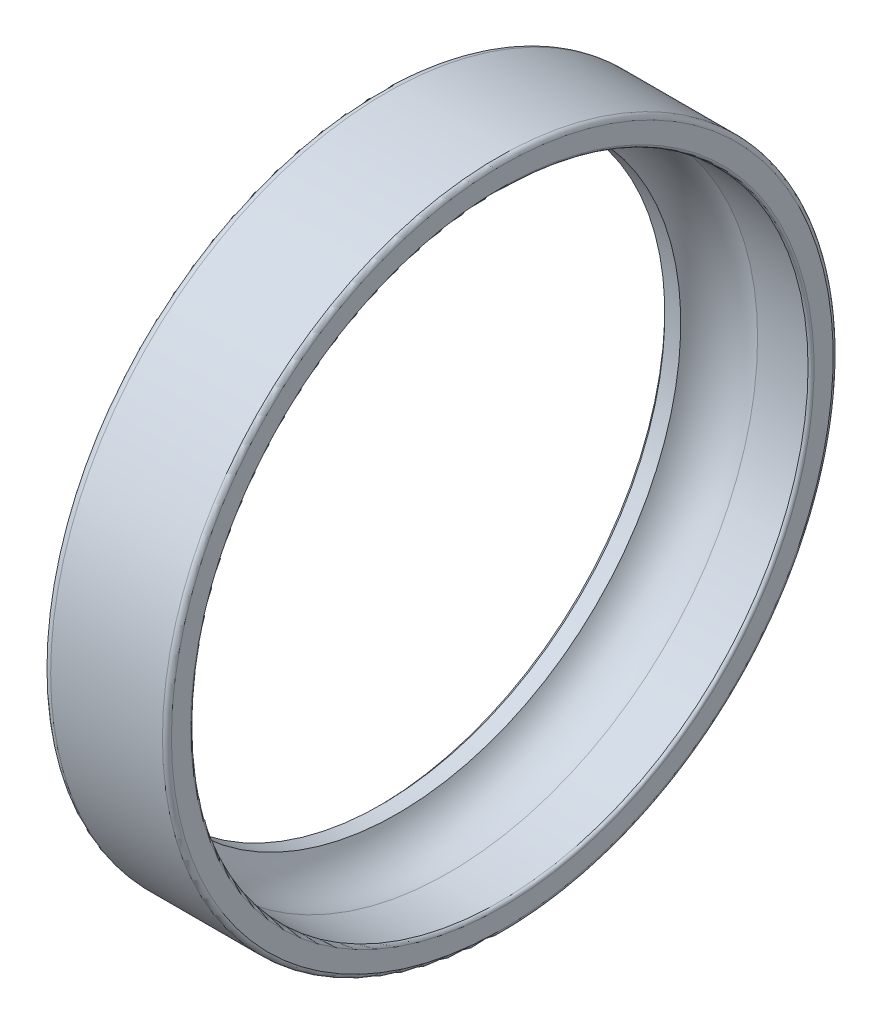
from build123d import *


with BuildPart() as part:
    # Schizzo1 → Rivoluzione1 (revolve)
    with BuildSketch(Plane.XY, mode=Mode.PRIVATE) as rivoluzione1_sk:
        with BuildLine():
            Line((0, 64.35), (1, 63.35))
            Line((1, 63.35), (4.561250083, 63.35))
            ThreePointArc((4.561250083, 63.35), (9.32995439, 68.154290191), (16.039607805, 69.05))
            Line((16.039607805, 69.05), (27.333333333, 69.05))
            ThreePointArc((27.333333333, 69.05), (27.804737854, 69.245262146), (28, 69.716666667))
            Line((28, 69.716666667), (28, 74))
            ThreePointArc((28, 74), (27.707106781, 74.707106781), (27, 75))
            Line((27, 75), (2, 75))
            ThreePointArc((2, 75), (0.585786438, 74.414213562), (0, 73))
            Line((0, 73), (0, 64.35))
        make_face()
    revolve(rivoluzione1_sk.sketch.rotate(Axis((28, 0, 0), (-1, 0, 0)), 270), axis=Axis((28, 0, 0), (-1, 0, 0)))


solid = part.part
